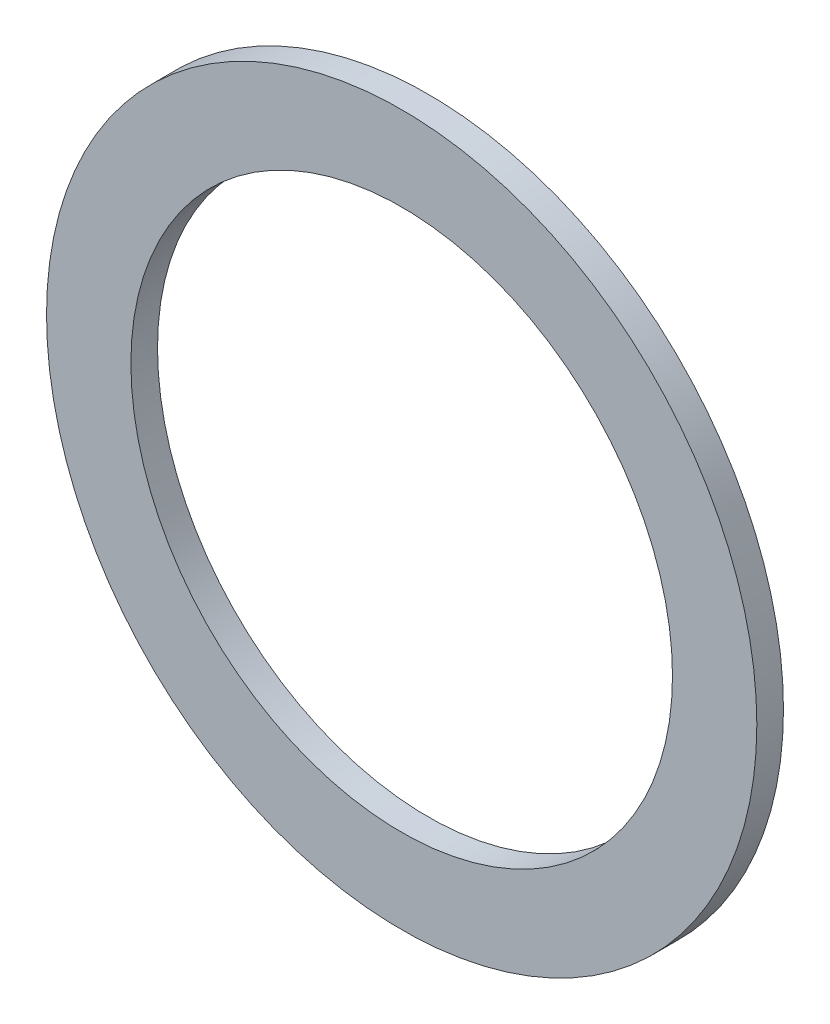
from build123d import *

# Parameters (mm, degrees)
PTFE_THRUST_FILM_H0P15_START = 1.8
SKETCH1_R                    = 2
SKETCH1_R_2                  = 1.525
PTFE_THRUST_FILM_H0P15_DEPTH = 0.15


with BuildPart() as part:
    # Sketch1 → PTFE_Thrust_Film_H0p15 (new body)
    with BuildSketch(Plane.XY.offset(PTFE_THRUST_FILM_H0P15_START)):
        Circle(SKETCH1_R)
        Circle(SKETCH1_R_2, mode=Mode.SUBTRACT)
    extrude(amount=PTFE_THRUST_FILM_H0P15_DEPTH)


solid = part.part
